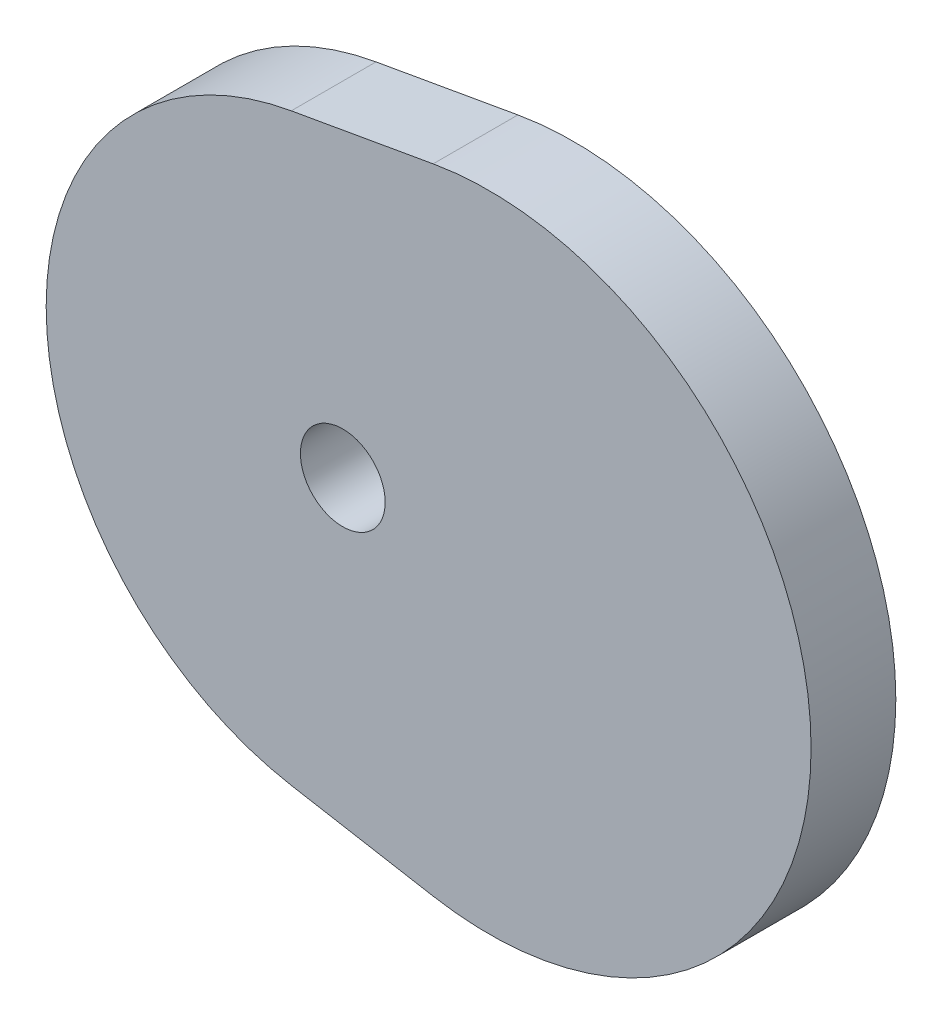
from build123d import *

# Parameters (mm, degrees)
EXTRUDE_1_DEPTH     = 10
SKETCH_2_R          = 5
CUT_EXTRUDE_1_DEPTH = 10


with BuildPart() as part:
    # 草图1 → 凸台-拉伸1 (new body)
    with BuildSketch(Plane.XY):
        with BuildLine():
            Line((2.795937925, 34.468271355), (19.537669726, 37.420290376))
            ThreePointArc((19.537669726, 37.420290376), (64.133435217, 0), (19.537669726, -37.420290376))
            Line((19.537669726, -37.420290376), (2.795937925, -34.468271355))
            ThreePointArc((2.795937925, -34.468271355), (-26.126375857, 0), (2.795937925, 34.468271355))
        make_face()
    extrude(amount=EXTRUDE_1_DEPTH)

    # 草图2 → 切除-拉伸1 (cut)
    with BuildSketch(Plane.XY.offset(10)):
        with Locations((8.873624143, 0)):
            Circle(SKETCH_2_R)
    extrude(amount=-CUT_EXTRUDE_1_DEPTH, mode=Mode.SUBTRACT)


solid = part.part
